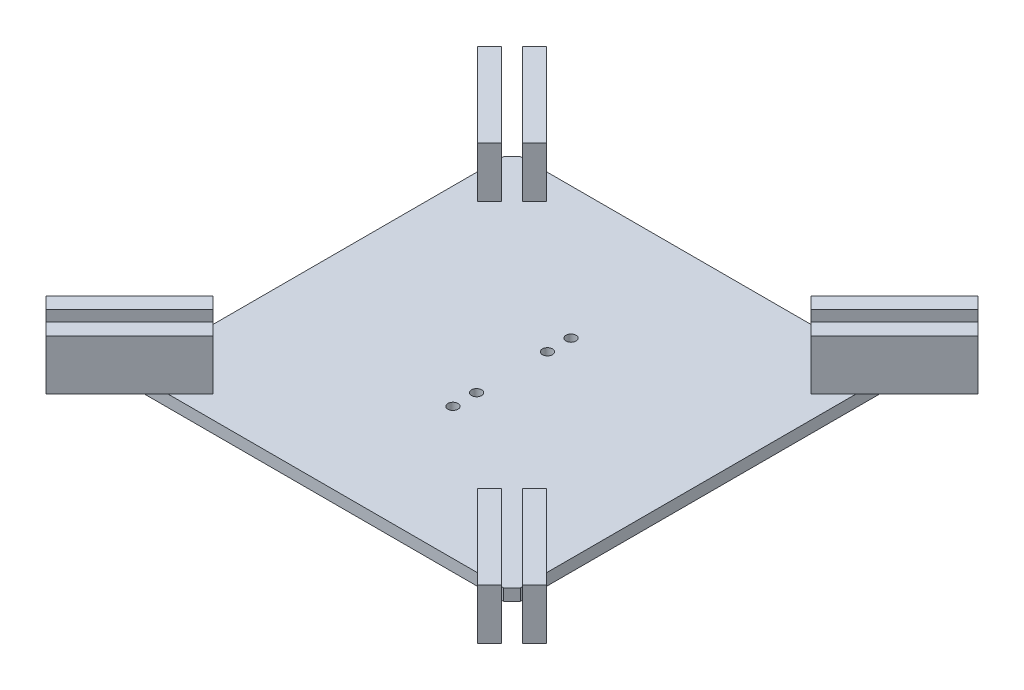
from build123d import *

# Parameters (mm, degrees)
SKETCH2_W           = 113.13708499
SKETCH2_H           = 113.13708499
BOSS_EXTRUDE1_DEPTH = 3.5
CHAMFER1_SIZE       = 2.5
BOSS_EXTRUDE3_DEPTH = 15
BOSS_EXTRUDE5_DEPTH = 15
CIRPATTERN11_COUNT  = 4
CUT_EXTRUDE3_START  = -18.5
SKETCH8_R           = 1.5
CUT_EXTRUDE3_DEPTH  = 18.5
SKETCH9_R           = 3.603183746
CUT_EXTRUDE4_DEPTH  = 10


with BuildPart() as part:
    # Sketch2 → Boss-Extrude1 (new body)
    with BuildSketch(Plane(origin=(0, 0, 0), x_dir=(1, 0, 0), z_dir=(0, 1, 0))):
        Rectangle(SKETCH2_W, SKETCH2_H)
    extrude(amount=BOSS_EXTRUDE1_DEPTH)

    # Chamfer1
    chamfer1_edges = [part.edges().sort_by_distance(p)[0] for p in [
        (56.568542495, 1.75, 56.568542495),
        (-56.568542495, 1.75, 56.568542495),
        (-56.568542495, 1.75, -56.568542495),
        (56.568542495, 1.75, -56.568542495),
    ]]
    chamfer(chamfer1_edges, length=CHAMFER1_SIZE)

    # Sketch3 → Boss-Extrude3 (add)
    with BuildSketch(Plane.XZ):
        Polygon((0, 10.253048327), (-3.535533906, 6.717514421), (0, 3.181980515), (3.535533906, 6.717514421), align=None)
        Polygon((-21.213203436, 24.395183951), (-3.535533906, 6.717514421), (0, 10.253048327), (-17.67766953, 27.930717857), align=None)
        Polygon((17.67766953, 27.930717857), (0, 10.253048327), (3.535533906, 6.717514421), (21.213203436, 24.395183951), align=None)
        Polygon((6.717514421, 3.535533906), (3.181980515, 0), (6.717514421, -3.535533906), (10.253048327, 0), align=None)
        Polygon((24.395183951, 21.213203436), (6.717514421, 3.535533906), (10.253048327, 0), (27.930717857, 17.67766953), align=None)
        Polygon((10.253048327, 0), (6.717514421, -3.535533906), (24.395183951, -21.213203436), (27.930717857, -17.67766953), align=None)
        Polygon((3.535533906, -6.717514421), (0, -3.181980515), (-3.535533906, -6.717514421), (0, -10.253048327), align=None)
        Polygon((21.213203436, -24.395183951), (3.535533906, -6.717514421), (0, -10.253048327), (17.67766953, -27.930717857), align=None)
        Polygon((0, -10.253048327), (-3.535533906, -6.717514421), (-21.213203436, -24.395183951), (-17.67766953, -27.930717857), align=None)
        Polygon((-6.717514421, -3.535533906), (-3.181980515, 0), (-6.717514421, 3.535533906), (-10.253048327, 0), align=None)
        Polygon((-24.395183951, -21.213203436), (-6.717514421, -3.535533906), (-10.253048327, 0), (-27.930717857, -17.67766953), align=None)
        Polygon((-10.253048327, 0), (-6.717514421, 3.535533906), (-24.395183951, 21.213203436), (-27.930717857, 17.67766953), align=None)
    extrude(amount=BOSS_EXTRUDE3_DEPTH)

    # Sketch6 → Boss-Extrude5 (add)
    with BuildSketch(Plane(origin=(0, 3.5, 0), x_dir=(1, 0, 0), z_dir=(0, 1, 0))):
        Polygon((-66.949331771, 70.131312286), (-42.20059443, 45.382574945), (-38.665060524, 48.918108851), (-63.413797865, 73.666846192), align=None)
        Polygon((-45.382574945, 42.20059443), (-48.918108851, 38.665060524), (-73.666846192, 63.413797865), (-70.131312286, 66.949331771), align=None)
    boss_extrude5 = extrude(amount=BOSS_EXTRUDE5_DEPTH)

    # CirPattern11: Boss-Extrude5 ×4 about axis
    cirpattern11_axis = Axis((0.511078202, 0, 0.511078202), (0, 1, 0))
    for i in range(1, CIRPATTERN11_COUNT):
        add(boss_extrude5.rotate(cirpattern11_axis, i * 360 / CIRPATTERN11_COUNT))

    # Sketch8 → Cut-Extrude3 (cut)
    with BuildSketch(Plane(origin=(0, 3.5, 0), x_dir=(1, 0, 0), z_dir=(0, 1, 0)).offset(CUT_EXTRUDE3_START)):
        with Locations(Location((0, 10.5, 0), (0, 0, 270))):
            Circle(SKETCH8_R)
        with Locations(Location((0, -10.5, 0), (0, 0, 270))):
            Circle(SKETCH8_R)
        with Locations(Location((0, 17.5, 0), (0, 0, 270))):
            Circle(SKETCH8_R)
        with Locations(Location((0, -17.5, 0), (0, 0, 270))):
            Circle(SKETCH8_R)
    extrude(amount=CUT_EXTRUDE3_DEPTH, mode=Mode.SUBTRACT)

    # Sketch9 → Cut-Extrude4 (cut)
    with BuildSketch(Plane.XZ):
        with Locations((0, 10.5)):
            Circle(SKETCH9_R)
        with Locations((0, -10.5)):
            Circle(SKETCH9_R)
    extrude(amount=CUT_EXTRUDE4_DEPTH, mode=Mode.SUBTRACT)


solid = part.part
